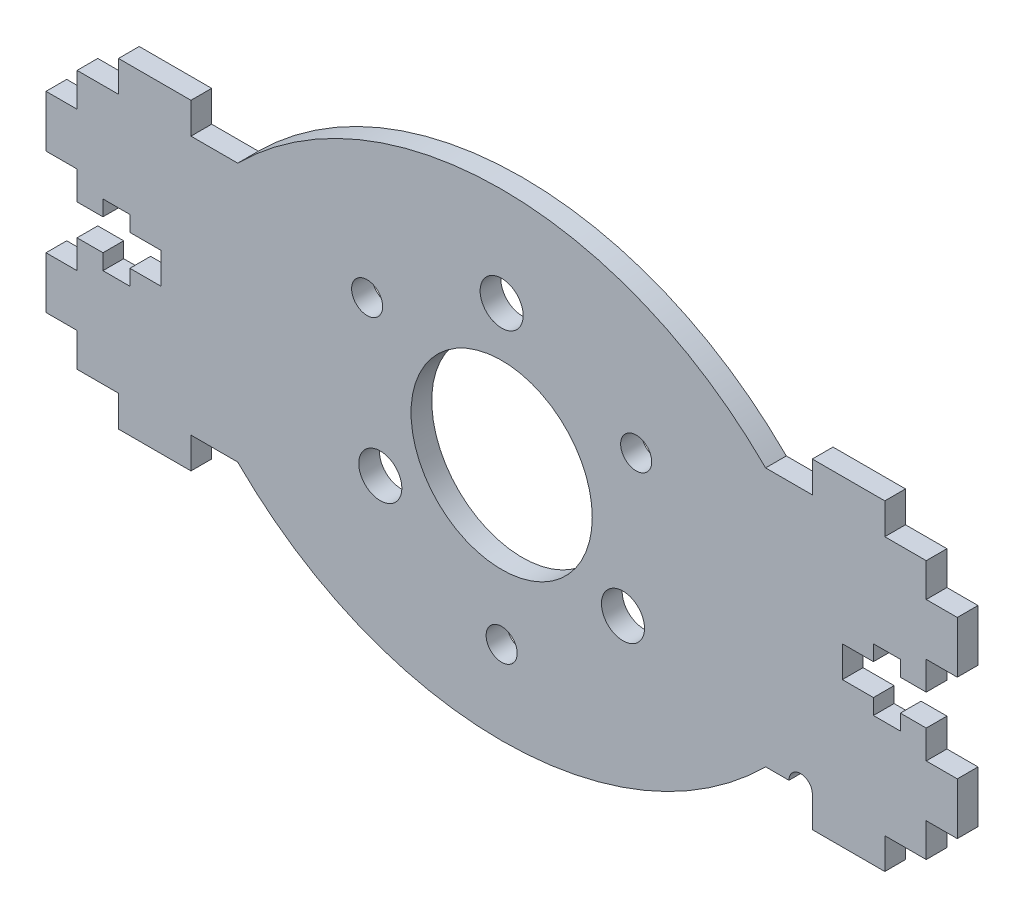
from build123d import *

# Parameters (mm, degrees)
SKETCH_1_R      = 2.08
SKETCH_1_R_2    = 8.75
SKETCH_1_R_3    = 1.5
EXTRUDE_2_DEPTH = 2


with BuildPart() as part:
    # 草图1 → 凸台-拉伸2 (new body)
    with BuildSketch(Plane.XY):
        with BuildLine():
            Line((25.488968202, 12.5), (30, 12.5))
            Line((30, 12.5), (30, 15.5))
            Line((30, 15.5), (37, 15.5))
            Line((37, 15.5), (37, 12.5))
            Line((37, 12.5), (41, 12.5))
            Line((41, 12.5), (41, 9.25))
            Line((41, 9.25), (44, 9.25))
            Line((44, 9.25), (44, 4.25))
            Line((44, 4.25), (41, 4.25))
            Line((41, 4.25), (41, 1.5))
            Line((41, 1.5), (38.5, 1.5))
            Line((38.5, 1.5), (38.5, 3))
            Line((38.5, 3), (35.9, 3))
            Line((35.9, 3), (35.9, 1.5))
            Line((35.9, 1.5), (32.9, 1.5))
            Line((32.9, 1.5), (32.9, -1.5))
            Line((32.9, -1.5), (35.9, -1.5))
            Line((35.9, -1.5), (35.9, -3))
            Line((35.9, -3), (38.5, -3))
            Line((38.5, -3), (38.5, -1.5))
            Line((38.5, -1.5), (41, -1.5))
            Line((41, -1.5), (41, -4.25))
            Line((41, -4.25), (44, -4.25))
            Line((44, -4.25), (44, -9.25))
            Line((44, -9.25), (41, -9.25))
            Line((41, -9.25), (41, -12.5))
            Line((41, -12.5), (37, -12.5))
            Line((37, -12.5), (37, -15.5))
            Line((37, -15.5), (30, -15.5))
            Line((30, -15.5), (30, -12.5))
            ThreePointArc((30, -12.5), (28.87224205, -11.37224205), (27.744484101, -12.5))
            Line((27.744484101, -12.5), (25.488968202, -12.5))
            ThreePointArc((25.488968202, -12.5), (0, -23.05787632), (-25.488968202, -12.5))
            Line((-25.488968202, -12.5), (-30, -12.5))
            Line((-30, -12.5), (-30, -15.5))
            Line((-30, -15.5), (-37, -15.5))
            Line((-37, -15.5), (-37, -12.5))
            Line((-37, -12.5), (-41, -12.5))
            Line((-41, -12.5), (-41, -9.25))
            Line((-41, -9.25), (-44, -9.25))
            Line((-44, -9.25), (-44, -4.25))
            Line((-44, -4.25), (-41, -4.25))
            Line((-41, -4.25), (-41, -1.5))
            Line((-41, -1.5), (-38.5, -1.5))
            Line((-38.5, -1.5), (-38.5, -3))
            Line((-38.5, -3), (-35.9, -3))
            Line((-35.9, -3), (-35.9, -1.5))
            Line((-35.9, -1.5), (-32.9, -1.5))
            Line((-32.9, -1.5), (-32.9, 1.5))
            Line((-32.9, 1.5), (-35.9, 1.5))
            Line((-35.9, 1.5), (-35.9, 3))
            Line((-35.9, 3), (-38.5, 3))
            Line((-38.5, 3), (-38.5, 1.5))
            Line((-38.5, 1.5), (-41, 1.5))
            Line((-41, 1.5), (-41, 4.25))
            Line((-41, 4.25), (-44, 4.25))
            Line((-44, 4.25), (-44, 9.25))
            Line((-44, 9.25), (-41, 9.25))
            Line((-41, 9.25), (-41, 12.5))
            Line((-41, 12.5), (-37, 12.5))
            Line((-37, 12.5), (-37, 15.5))
            Line((-37, 15.5), (-30, 15.5))
            Line((-30, 15.5), (-30, 12.5))
            Line((-30, 12.5), (-25.488968202, 12.5))
            ThreePointArc((-25.488968202, 12.5), (0, 23.05787632), (25.488968202, 12.5))
        make_face()
        with Locations((0, 13.53)):
            Circle(SKETCH_1_R, mode=Mode.SUBTRACT)
        with Locations((11.717323713, -6.765)):
            Circle(SKETCH_1_R, mode=Mode.SUBTRACT)
        with Locations((-11.717323713, -6.765)):
            Circle(SKETCH_1_R, mode=Mode.SUBTRACT)
        Circle(SKETCH_1_R_2, mode=Mode.SUBTRACT)
        with Locations((-12.990381057, 7.5)):
            Circle(SKETCH_1_R_3, mode=Mode.SUBTRACT)
        with Locations((12.990381057, 7.5)):
            Circle(SKETCH_1_R_3, mode=Mode.SUBTRACT)
        with Locations((0, -15)):
            Circle(SKETCH_1_R_3, mode=Mode.SUBTRACT)
    extrude(amount=EXTRUDE_2_DEPTH)


solid = part.part
